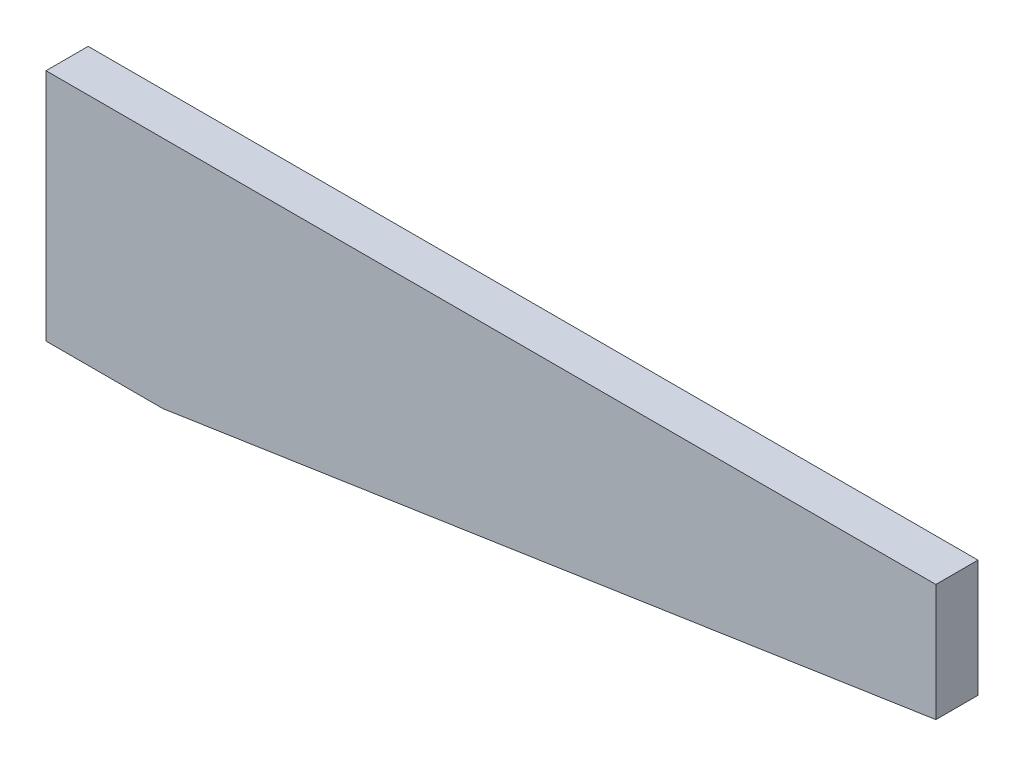
from build123d import *

# Parameters (mm, degrees)
ESQUISSE1_W                  = 570
ESQUISSE1_H                  = 150
BOSS_EXTRU_1_DEPTH           = 27
ENL_V_MAT_EXTRU_1_DEPTH      = 591.024575759
ENL_V_MAT_EXTRU_1_DEPTH_BACK = 591.024575759


with BuildPart() as part:
    # Esquisse1 → Boss.-Extru.1 (new body)
    with BuildSketch(Plane.XY):
        with Locations((285, 75)):
            Rectangle(ESQUISSE1_W, ESQUISSE1_H)
    extrude(amount=BOSS_EXTRU_1_DEPTH)

    # Esquisse2 → Enlèv. mat.-Extru.1 (cut, two sides: drawn at the far end of the back side and taken through both)
    with BuildSketch(Plane.XY.offset(27).offset(-ENL_V_MAT_EXTRU_1_DEPTH_BACK)):
        Polygon((75, 0), (570, 75), (570, 0), align=None)
    extrude(amount=ENL_V_MAT_EXTRU_1_DEPTH + ENL_V_MAT_EXTRU_1_DEPTH_BACK, mode=Mode.SUBTRACT)


solid = part.part
